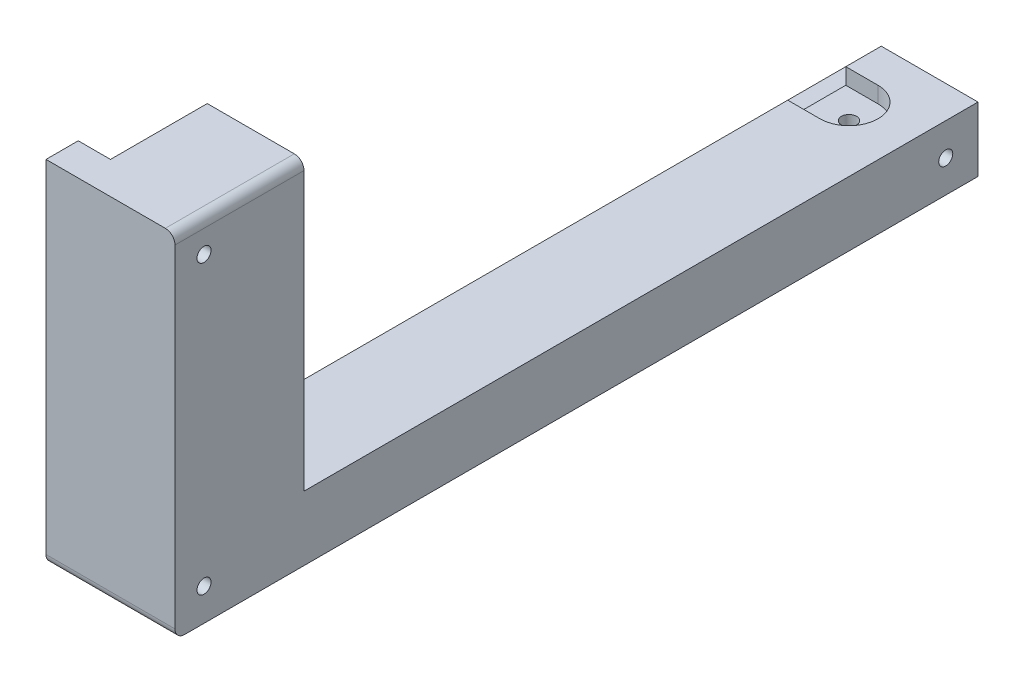
from build123d import *

# Parameters (mm, degrees)
SKETCH1_W               = 40
SKETCH1_H               = 249
BOSS_EXTRUDE1_DEPTH     = 20
SKETCH2_W               = 40
SKETCH2_H               = 40
BOSS_EXTRUDE2_DEPTH     = 89.09
CUT_EXTRUDE1_DEPTH      = 100
CUT_EXTRUDE1_DEPTH_BACK = 10
SKETCH3_W               = 10
SKETCH3_H               = 239
SKETCH6_W               = 30
SKETCH6_H               = 20
CUT_EXTRUDE4_DEPTH      = 20
SKETCH4_R               = 2.35
CUT_EXTRUDE2_DEPTH      = 23
CUT_EXTRUDE3_DEPTH      = 5
SKETCH7_R               = 2.175
CUT_EXTRUDE5_DEPTH      = 8
FILLET1_R               = 3


with BuildPart() as part:
    # Sketch1 → Boss-Extrude1 (new body)
    with BuildSketch(Plane(origin=(0, 0, 0), x_dir=(1, 0, 0), z_dir=(0, 1, 0))):
        Rectangle(SKETCH1_W, SKETCH1_H)
    extrude(amount=BOSS_EXTRUDE1_DEPTH)

    # Sketch2 → Boss-Extrude2 (add)
    with BuildSketch(Plane(origin=(0, 20, 0), x_dir=(1, 0, 0), z_dir=(0, 1, 0))):
        with Locations((0, -104.5)):
            Rectangle(SKETCH2_W, SKETCH2_H)
    extrude(amount=BOSS_EXTRUDE2_DEPTH)

    # Sketch3 → Cut-Extrude1 (cut, two sides: drawn at the far end of the back side and taken through both)
    with BuildSketch(Plane(origin=(0, 20, 0), x_dir=(1, 0, 0), z_dir=(0, 1, 0)).offset(-CUT_EXTRUDE1_DEPTH_BACK)):
        with Locations((-15, 5)):
            Rectangle(SKETCH3_W, SKETCH3_H)
    extrude(amount=CUT_EXTRUDE1_DEPTH + CUT_EXTRUDE1_DEPTH_BACK, mode=Mode.SUBTRACT)

    # Sketch6 → Cut-Extrude4 (cut)
    with BuildSketch(Plane.ZY.offset(10)):
        with Locations((99.5, 30)):
            Rectangle(SKETCH6_W, SKETCH6_H)
    extrude(amount=-CUT_EXTRUDE4_DEPTH, mode=Mode.SUBTRACT)

    # Sketch4 → Cut-Extrude2 (cut)
    with BuildSketch(Plane(origin=(0, 20, 0), x_dir=(1, 0, 0), z_dir=(0, 1, 0))):
        with Locations(Location((0, 104.5, 0), (0, 0, 270))):
            Circle(SKETCH4_R)
        with Locations(Location((0, -105.5, 0), (0, 0, 270))):
            Circle(SKETCH4_R)
    extrude(amount=-CUT_EXTRUDE2_DEPTH, mode=Mode.SUBTRACT)

    # Sketch5 → Cut-Extrude3 (cut)
    with BuildSketch(Plane(origin=(0, 20, 0), x_dir=(1, 0, 0), z_dir=(0, 1, 0))):
        with BuildLine():
            Line((0, 95.5), (-10, 95.5))
            Line((-10, 95.5), (-10, 113.5))
            Line((-10, 113.5), (0, 113.5))
            ThreePointArc((0, 113.5), (9, 104.5), (0, 95.5))
        make_face()
        with BuildLine():
            Line((0, -96.5), (-20, -96.5))
            Line((-20, -96.5), (-20, -114.5))
            Line((-20, -114.5), (0, -114.5))
            ThreePointArc((0, -114.5), (9, -105.5), (0, -96.5))
        make_face()
    extrude(amount=-CUT_EXTRUDE3_DEPTH, mode=Mode.SUBTRACT)

    # Sketch7 → Cut-Extrude5 (cut)
    with BuildSketch(Plane(origin=(20, 0, 0), x_dir=(0, 0, -1), z_dir=(1, 0, 0))):
        with Locations((114.5, 10)):
            Circle(SKETCH7_R)
        with Locations((-115.5, 10)):
            Circle(SKETCH7_R)
        with Locations((-115.5, 99.09)):
            Circle(SKETCH7_R)
    extrude(amount=-CUT_EXTRUDE5_DEPTH, mode=Mode.SUBTRACT)

    # Fillet1
    fillet1_edges = [part.edges().sort_by_distance(p)[0] for p in [
        (20, 109.09, 104.5),
        (0, 0, 124.5),
    ]]
    fillet(fillet1_edges, radius=FILLET1_R)


solid = part.part
